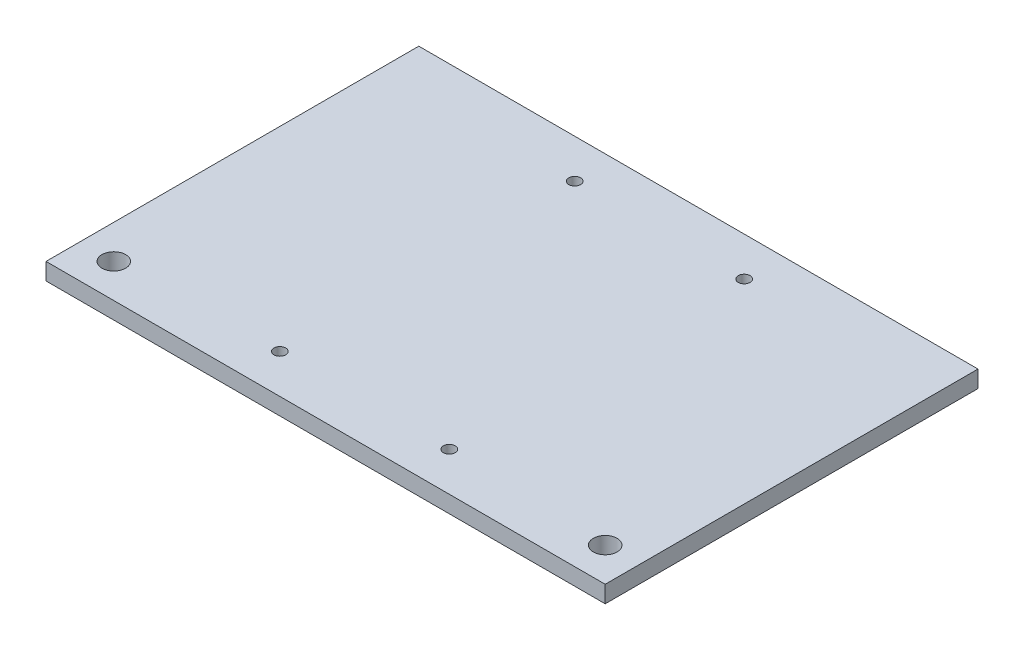
from build123d import *

# Parameters (mm, degrees)
SKETCH1_W           = 165
SKETCH1_H           = 110
SKETCH1_R           = 3.5
SKETCH1_R_2         = 1.75
BOSS_EXTRUDE1_DEPTH = 5


with BuildPart() as part:
    # Sketch1 → Boss-Extrude1 (new body)
    with BuildSketch(Plane(origin=(0, 0, 0), x_dir=(1, 0, 0), z_dir=(0, 1, 0))):
        Rectangle(SKETCH1_W, SKETCH1_H)
        with Locations(Location((72.5, -45, 0), (0, 0, 270))):
            Circle(SKETCH1_R, mode=Mode.SUBTRACT)
        with Locations(Location((-72.5, -45, 0), (0, 0, 270))):
            Circle(SKETCH1_R, mode=Mode.SUBTRACT)
        with Locations(Location((25, -43.5, 0), (0, 0, 270))):
            Circle(SKETCH1_R_2, mode=Mode.SUBTRACT)
        with Locations(Location((-25, -43.5, 0), (0, 0, 270))):
            Circle(SKETCH1_R_2, mode=Mode.SUBTRACT)
        with Locations(Location((-25, 43.5, 0), (0, 0, 270))):
            Circle(SKETCH1_R_2, mode=Mode.SUBTRACT)
        with Locations(Location((25, 43.5, 0), (0, 0, 270))):
            Circle(SKETCH1_R_2, mode=Mode.SUBTRACT)
    extrude(amount=BOSS_EXTRUDE1_DEPTH)


solid = part.part
